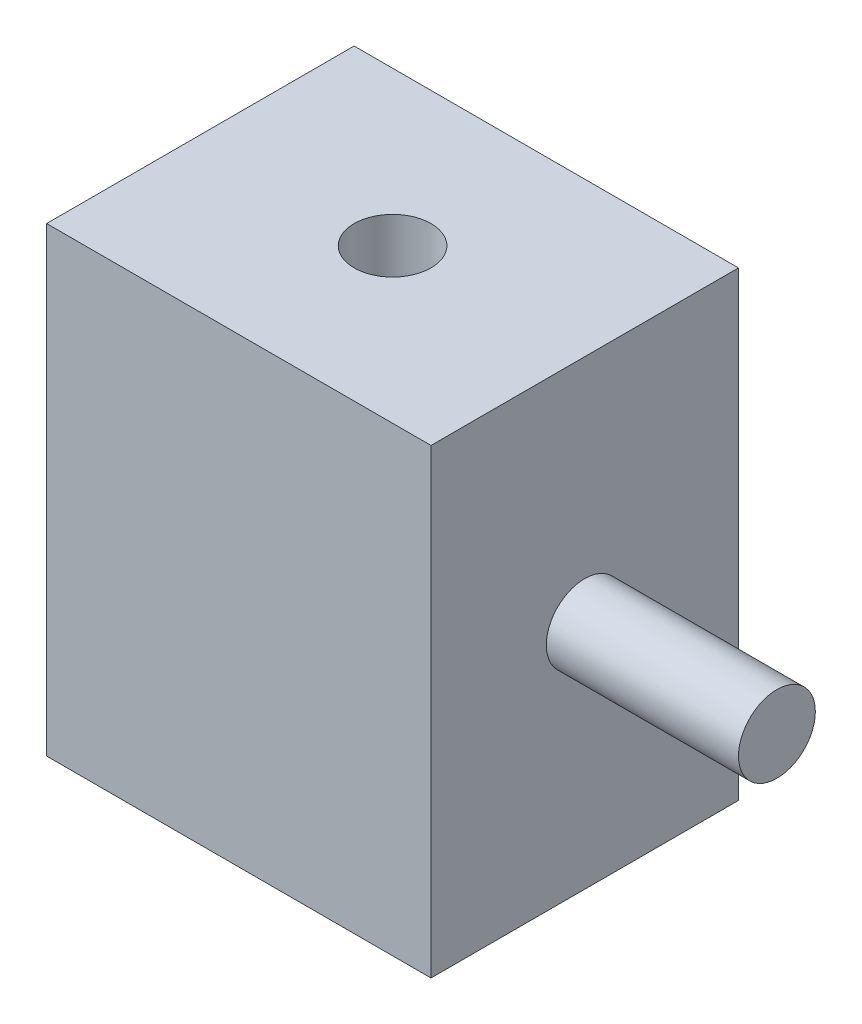
from build123d import *

# Parameters (mm, degrees)
SKETCH_1_W          = 10
SKETCH_1_H          = 12
EXTRUDE_1_DEPTH     = 8
SKETCH_5_R          = 1
EXTRUDE_4_DEPTH     = 5
SKETCH_6_R          = 1
CUT_EXTRUDE_1_DEPTH = 16


with BuildPart() as part:
    # 草图1 → 凸台-拉伸1 (new body)
    with BuildSketch(Plane.XY):
        Rectangle(SKETCH_1_W, SKETCH_1_H)
    extrude(amount=EXTRUDE_1_DEPTH)

    # 草图5 → 凸台-拉伸4 (add)
    with BuildSketch(Plane(origin=(5, 0, 0), x_dir=(0, 0, -1), z_dir=(1, 0, 0))):
        with Locations(Location((-4, 0, 0), (0, 0, 180))):
            Circle(SKETCH_5_R)
    extrude(amount=EXTRUDE_4_DEPTH)

    # 草图6 → 切除-拉伸1 (cut)
    with BuildSketch(Plane.XZ.offset(6)):
        with Locations(Location((0, 4, 0), (0, 0, 270))):
            Circle(SKETCH_6_R)
    extrude(amount=-CUT_EXTRUDE_1_DEPTH, mode=Mode.SUBTRACT)


solid = part.part
